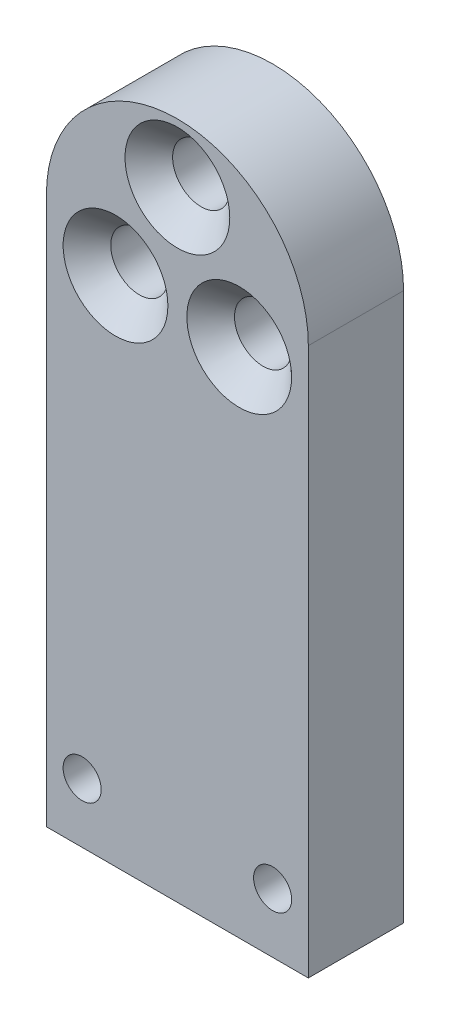
from build123d import *

# Parameters (mm, degrees)
RESSALTO_EXTRUS_O1_DEPTH                             = 4
FURO_ROSCADO_DE_M21_D                                = 1.6
ESCAREADO_PARA_PARAFUSO_COM_CABE_A_ESCAR_D           = 2.4
ESCAREADO_PARA_PARAFUSO_COM_CABE_A_ESCAR_CSINK_D     = 4.4
ESCAREADO_PARA_PARAFUSO_COM_CABE_A_ESCAR_CSINK_ANGLE = 90
PADR_OCIRCULAR1_COUNT                                = 3


with BuildPart() as part:
    # Esboço1 → Ressalto-extrusão1 (new body)
    with BuildSketch(Plane.XY):
        with BuildLine():
            Line((-5.5, 0), (-5.5, -23))
            Line((-5.5, -23), (5.5, -23))
            Line((5.5, -23), (5.5, 0))
            ThreePointArc((5.5, 0), (0, 5.5), (-5.5, 0))
        make_face()
    extrude(amount=RESSALTO_EXTRUS_O1_DEPTH)

    # Furo roscado de M21 (through all)
    with Locations(Plane(origin=(-4, -20.5, 4), x_dir=(1, 0, 0), z_dir=(0, 0, 1))):
        with Locations((0, 0), (8, 0)):
            Hole(FURO_ROSCADO_DE_M21_D / 2)

    # Escareado para parafuso com cabeça escareada chata de M21 (through all)
    with Locations(Plane(origin=(0, 3, 4), x_dir=(1, 0, 0), z_dir=(0, 0, 1))):
        with Locations((0, 0)):
            escareado_para_parafuso_com_cabe_a_escar = CounterSinkHole(ESCAREADO_PARA_PARAFUSO_COM_CABE_A_ESCAR_D / 2, ESCAREADO_PARA_PARAFUSO_COM_CABE_A_ESCAR_CSINK_D / 2, counter_sink_angle=ESCAREADO_PARA_PARAFUSO_COM_CABE_A_ESCAR_CSINK_ANGLE)

    # PadrãoCircular1: Escareado para parafuso com cabeça escareada chata de M21 ×3 about axis
    padr_ocircular1_axis = Axis((0, 0, 0), (0, 0, 1))
    for i in range(1, PADR_OCIRCULAR1_COUNT):
        add(escareado_para_parafuso_com_cabe_a_escar.rotate(padr_ocircular1_axis, i * 360 / PADR_OCIRCULAR1_COUNT), mode=Mode.SUBTRACT)


solid = part.part
